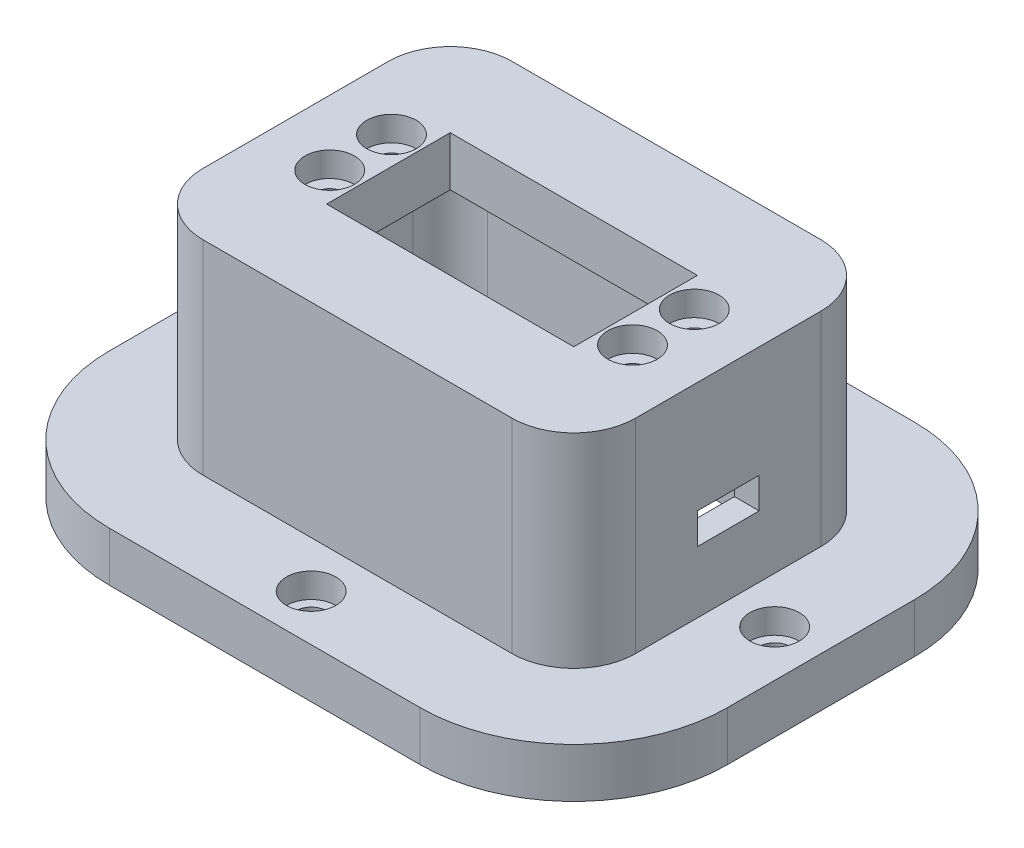
from build123d import *

# Parameters (mm, degrees)
CROQUIS1_W              = 70
CROQUIS1_H              = 50
CROQUIS1_W_2            = 40
CROQUIS1_H_2            = 20
SALIENTE_EXTRUIR1_DEPTH = 8
CROQUIS2_R              = 2
CORTAR_EXTRUIR1_DEPTH   = 15
REDONDEO3_R             = 10
SALIENTE_EXTRUIR2_DEPTH = 25
SALIENTE_EXTRUIR3_DEPTH = 8
CROQUIS5_R              = 2.5
CORTAR_EXTRUIR2_DEPTH   = 10
CROQUIS6_W              = 10
CROQUIS6_H              = 5
CORTAR_EXTRUIR3_DEPTH   = 15
CROQUIS7_R              = 4
CORTAR_EXTRUIR4_DEPTH   = 4
CROQUIS8_R              = 4
CORTAR_EXTRUIR5_DEPTH   = 4


with BuildPart() as part:
    # Croquis1 → Saliente-Extruir1 (new body)
    with BuildSketch(Plane(origin=(0, 0, 0), x_dir=(1, 0, 0), z_dir=(0, 1, 0))):
        Rectangle(CROQUIS1_W, CROQUIS1_H)
        Rectangle(CROQUIS1_W_2, CROQUIS1_H_2, mode=Mode.SUBTRACT)
    extrude(amount=SALIENTE_EXTRUIR1_DEPTH)

    # Croquis2 → Cortar-Extruir1 (cut)
    with BuildSketch(Plane(origin=(0, 8, 0), x_dir=(1, 0, 0), z_dir=(0, 1, 0))):
        with Locations(Location((24.5, -5, 0), (0, 0, 270))):
            Circle(CROQUIS2_R)
        with Locations(Location((24.5, 5, 0), (0, 0, 270))):
            Circle(CROQUIS2_R)
        with Locations(Location((-24.5, -5, 0), (0, 0, 270))):
            Circle(CROQUIS2_R)
        with Locations(Location((-24.5, 5, 0), (0, 0, 270))):
            Circle(CROQUIS2_R)
    extrude(amount=-CORTAR_EXTRUIR1_DEPTH, mode=Mode.SUBTRACT)

    # Redondeo3
    redondeo3_edges = [part.edges().sort_by_distance(p)[0] for p in [
        (-35, 4, -25),
        (35, 4, -25),
        (35, 4, 25),
        (-35, 4, 25),
    ]]
    fillet(redondeo3_edges, radius=REDONDEO3_R)

    # Croquis3 → Saliente-Extruir2 (add)
    with BuildSketch(Plane.XZ):
        with BuildLine():
            Line((-25, 25), (25, 25))
            ThreePointArc((25, 25), (32.071067812, 22.071067812), (35, 15))
            Line((35, 15), (35, -15))
            ThreePointArc((35, -15), (32.071067812, -22.071067812), (25, -25))
            Line((25, -25), (-25, -25))
            ThreePointArc((-25, -25), (-32.071067812, -22.071067812), (-35, -15))
            Line((-35, -15), (-35, 15))
            ThreePointArc((-35, 15), (-32.071067812, 22.071067812), (-25, 25))
        make_face()
        with BuildLine():
            Line((-25, 21), (25, 21))
            ThreePointArc((25, 21), (29.242640687, 19.242640687), (31, 15))
            Line((31, 15), (31, -15))
            ThreePointArc((31, -15), (29.242640687, -19.242640687), (25, -21))
            Line((25, -21), (-25, -21))
            ThreePointArc((-25, -21), (-29.242640687, -19.242640687), (-31, -15))
            Line((-31, -15), (-31, 15))
            ThreePointArc((-31, 15), (-29.242640687, 19.242640687), (-25, 21))
        make_face(mode=Mode.SUBTRACT)
    extrude(amount=SALIENTE_EXTRUIR2_DEPTH)

    # Croquis6 → Cortar-Extruir3 (cut)
    with BuildSketch(Plane(origin=(35, 0, 0), x_dir=(0, 0, -1), z_dir=(1, 0, 0))):
        with Locations((0, -12.5)):
            Rectangle(CROQUIS6_W, CROQUIS6_H)
    extrude(amount=-CORTAR_EXTRUIR3_DEPTH, mode=Mode.SUBTRACT)

    # Croquis7 → Cortar-Extruir4 (cut)
    with BuildSketch(Plane(origin=(0, 8, 0), x_dir=(1, 0, 0), z_dir=(0, 1, 0))):
        with Locations(Location((24.5, 5, 0), (0, 0, 270))):
            Circle(CROQUIS7_R)
        with Locations(Location((24.5, -5, 0), (0, 0, 90))):
            Circle(CROQUIS7_R)
        with Locations(Location((-24.5, -5, 0), (0, 0, 270))):
            Circle(CROQUIS7_R)
        with Locations(Location((-24.5, 5, 0), (0, 0, 90))):
            Circle(CROQUIS7_R)
    extrude(amount=-CORTAR_EXTRUIR4_DEPTH, mode=Mode.SUBTRACT)


with BuildPart() as body_2:
    # Croquis4 → Saliente-Extruir3 (new body)
    with BuildSketch(Plane.XZ.offset(25)):
        with BuildLine():
            Line((-25.152646878, 40), (25.152646878, 40))
            ThreePointArc((25.152646878, 40), (42.722378765, 32.722378765), (50, 15.152646878))
            Line((50, 15.152646878), (50, -15.152646878))
            ThreePointArc((50, -15.152646878), (42.722378765, -32.722378765), (25.152646878, -40))
            Line((25.152646878, -40), (-25.152646878, -40))
            ThreePointArc((-25.152646878, -40), (-42.722378765, -32.722378765), (-50, -15.152646878))
            Line((-50, -15.152646878), (-50, 15.152646878))
            ThreePointArc((-50, 15.152646878), (-42.722378765, 32.722378765), (-25.152646878, 40))
        make_face()
        with BuildLine():
            Line((-25, 21), (25, 21))
            ThreePointArc((25, 21), (29.242640687, 19.242640687), (31, 15))
            Line((31, 15), (31, -15))
            ThreePointArc((31, -15), (29.242640687, -19.242640687), (25, -21))
            Line((25, -21), (-25, -21))
            ThreePointArc((-25, -21), (-29.242640687, -19.242640687), (-31, -15))
            Line((-31, -15), (-31, 15))
            ThreePointArc((-31, 15), (-29.242640687, 19.242640687), (-25, 21))
        make_face(mode=Mode.SUBTRACT)
    extrude(amount=SALIENTE_EXTRUIR3_DEPTH)

    # Croquis5 → Cortar-Extruir2 (cut)
    with BuildSketch(Plane(origin=(0, -25, 0), x_dir=(1, 0, 0), z_dir=(0, 1, 0))):
        with Locations(Location((-42.5, 0, 0), (0, 0, 270))):
            Circle(CROQUIS5_R)
        with Locations(Location((0, 32.5, 0), (0, 0, 270))):
            Circle(CROQUIS5_R)
        with Locations(Location((0, -32.5, 0), (0, 0, 270))):
            Circle(CROQUIS5_R)
        with Locations(Location((42.5, 0, 0), (0, 0, 270))):
            Circle(CROQUIS5_R)
    extrude(amount=-CORTAR_EXTRUIR2_DEPTH, mode=Mode.SUBTRACT)

    # Croquis8 → Cortar-Extruir5 (cut)
    with BuildSketch(Plane(origin=(0, -25, 0), x_dir=(1, 0, 0), z_dir=(0, 1, 0))):
        with Locations(Location((0, 32.5, 0), (0, 0, 270))):
            Circle(CROQUIS8_R)
        with Locations(Location((0, -32.5, 0), (0, 0, 90))):
            Circle(CROQUIS8_R)
        with Locations(Location((42.5, 0, 0), (0, 0, 270))):
            Circle(CROQUIS8_R)
        with Locations(Location((-42.5, 0, 0), (0, 0, 90))):
            Circle(CROQUIS8_R)
    extrude(amount=-CORTAR_EXTRUIR5_DEPTH, mode=Mode.SUBTRACT)


solid = Compound([part.part, body_2.part])
